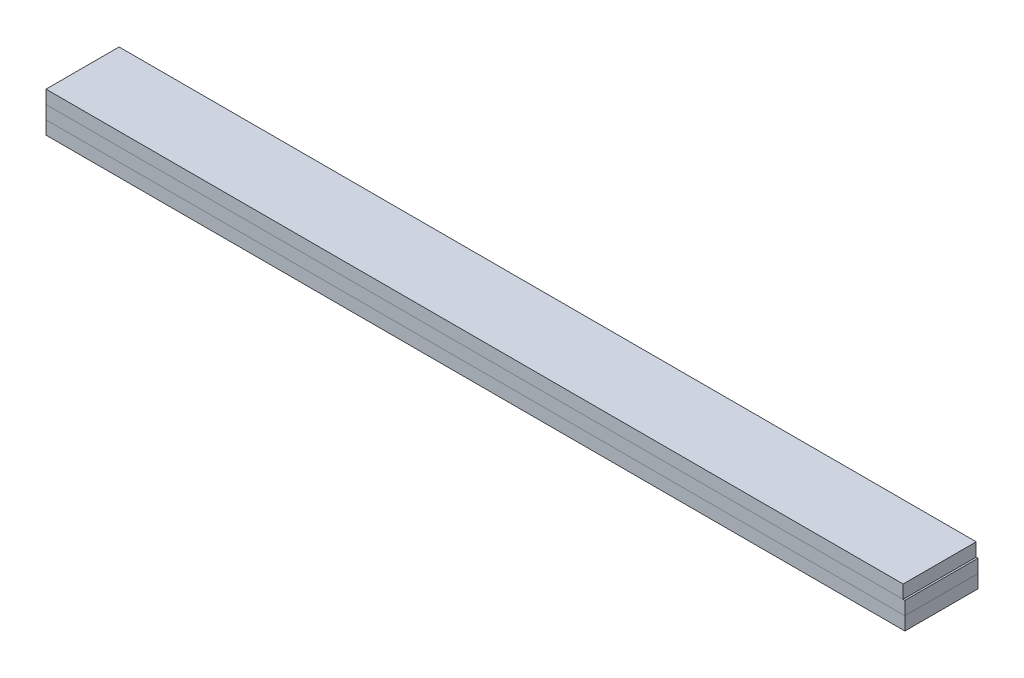
from build123d import *

# Parameters (mm, degrees)
SKETCH2_W           = 69.7
SKETCH2_H           = 5.5
BOSS_EXTRUDE1_DEPTH = 1
SKETCH4_W           = 69.7
SKETCH4_H           = 5.5
BOSS_EXTRUDE2_DEPTH = 1
SKETCH5_W           = 69.517
SKETCH5_H           = 5.5
BOSS_EXTRUDE3_DEPTH = 1
SKETCH7_W           = 5.2
SKETCH7_H           = 5.5
CUT_EXTRUDE3_DEPTH  = 1
SKETCH8_W           = 5.066150396
SKETCH8_H           = 5.5
CUT_EXTRUDE4_DEPTH  = 20


with BuildPart() as part:
    # Sketch2 → Boss-Extrude1 (new body)
    with BuildSketch(Plane(origin=(0, 0, 0), x_dir=(1, 0, 0), z_dir=(0, 1, 0))):
        with Locations((-0.517013938, 0.358810535)):
            Rectangle(SKETCH2_W, SKETCH2_H)
    extrude(amount=BOSS_EXTRUDE1_DEPTH)


with BuildPart() as body_2:
    # Sketch4 → Boss-Extrude2 (new body)
    with BuildSketch(Plane(origin=(0, 1, 0), x_dir=(1, 0, 0), z_dir=(0, 1, 0))):
        with Locations((-0.517013938, 0.358810535)):
            Rectangle(SKETCH4_W, SKETCH4_H)
    extrude(amount=BOSS_EXTRUDE2_DEPTH)


with BuildPart() as body_3:
    # Sketch5 → Boss-Extrude3 (new body)
    with BuildSketch(Plane(origin=(0, 2, 0), x_dir=(1, 0, 0), z_dir=(0, 1, 0))):
        with Locations((-0.608513938, 0.358810535)):
            Rectangle(SKETCH5_W, SKETCH5_H)
    extrude(amount=BOSS_EXTRUDE3_DEPTH)

    # Sketch7 → Cut-Extrude3 (cut)
    with BuildSketch(Plane(origin=(0, 3, 0), x_dir=(1, 0, 0), z_dir=(0, 1, 0))):
        with Locations((31.732986062, 0.358810535)):
            Rectangle(SKETCH7_W, SKETCH7_H)
    extrude(amount=-CUT_EXTRUDE3_DEPTH, mode=Mode.SUBTRACT)


with BuildPart() as cut_extrude4_tool:
    # Sketch8 → Cut-Extrude4 (new body)
    with BuildSketch(Plane(origin=(0, 2, 0), x_dir=(1, 0, 0), z_dir=(0, 1, 0))):
        with Locations((31.799910864, 0.358810535)):
            Rectangle(SKETCH8_W, SKETCH8_H)
    extrude(amount=-CUT_EXTRUDE4_DEPTH)


with BuildPart() as part_1:
    add(part.part)

    # Cut-Extrude4: cut by cut_extrude4_tool
    add(cut_extrude4_tool.part, mode=Mode.SUBTRACT)


with BuildPart() as body_2_1:
    add(body_2.part)

    # Cut-Extrude4: cut by cut_extrude4_tool
    add(cut_extrude4_tool.part, mode=Mode.SUBTRACT)


solid = Compound([body_3.part, part_1.part, body_2_1.part])
